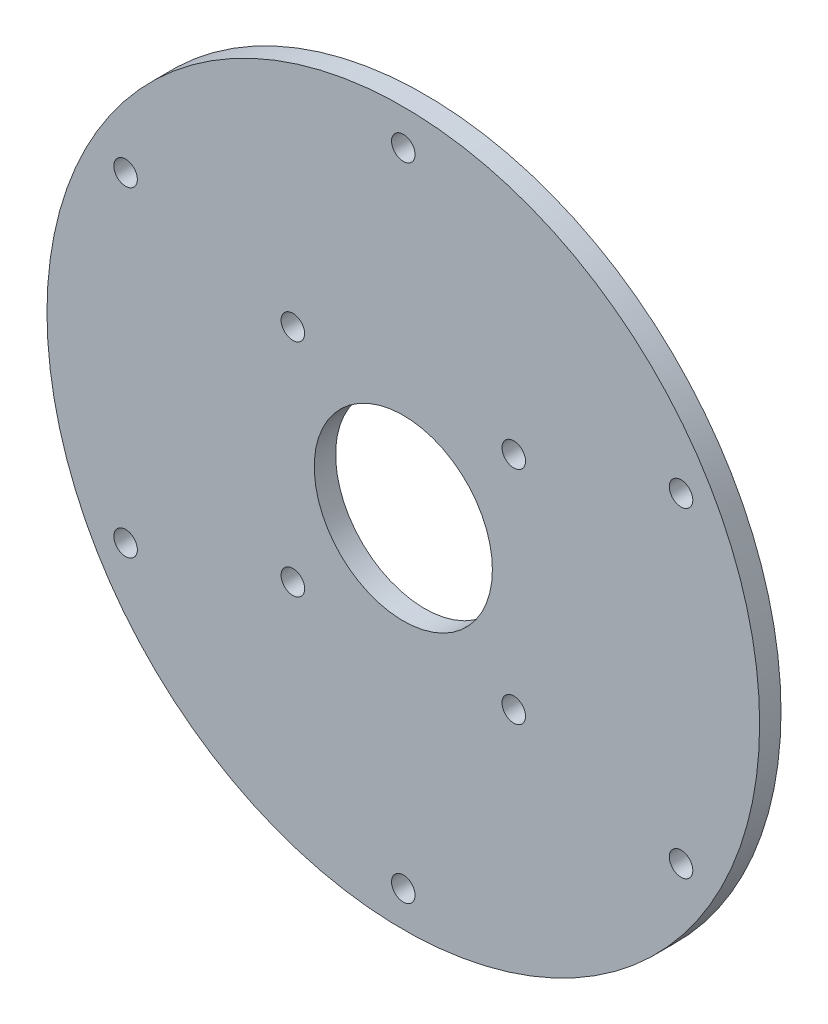
from build123d import *

# Parameters (mm, degrees)
SKETCH_1_R      = 50
SKETCH_1_R_2    = 1.65
SKETCH_1_R_3    = 12.5
EXTRUDE_1_DEPTH = 3


with BuildPart() as part:
    # 草图1 → 凸台-拉伸1 (new body)
    with BuildSketch(Plane.XY):
        Circle(SKETCH_1_R)
        with Locations((-15.5, 15.5)):
            Circle(SKETCH_1_R_2, mode=Mode.SUBTRACT)
        with Locations((15.5, 15.5)):
            Circle(SKETCH_1_R_2, mode=Mode.SUBTRACT)
        with Locations((15.5, -15.5)):
            Circle(SKETCH_1_R_2, mode=Mode.SUBTRACT)
        with Locations((-15.5, -15.5)):
            Circle(SKETCH_1_R_2, mode=Mode.SUBTRACT)
        Circle(SKETCH_1_R_3, mode=Mode.SUBTRACT)
        with Locations((-38.97114317, 22.5)):
            Circle(SKETCH_1_R_2, mode=Mode.SUBTRACT)
        with Locations((0, 45)):
            Circle(SKETCH_1_R_2, mode=Mode.SUBTRACT)
        with Locations((38.97114317, 22.5)):
            Circle(SKETCH_1_R_2, mode=Mode.SUBTRACT)
        with Locations((38.97114317, -22.5)):
            Circle(SKETCH_1_R_2, mode=Mode.SUBTRACT)
        with Locations((0, -45)):
            Circle(SKETCH_1_R_2, mode=Mode.SUBTRACT)
        with Locations((-38.97114317, -22.5)):
            Circle(SKETCH_1_R_2, mode=Mode.SUBTRACT)
    extrude(amount=EXTRUDE_1_DEPTH)


solid = part.part
